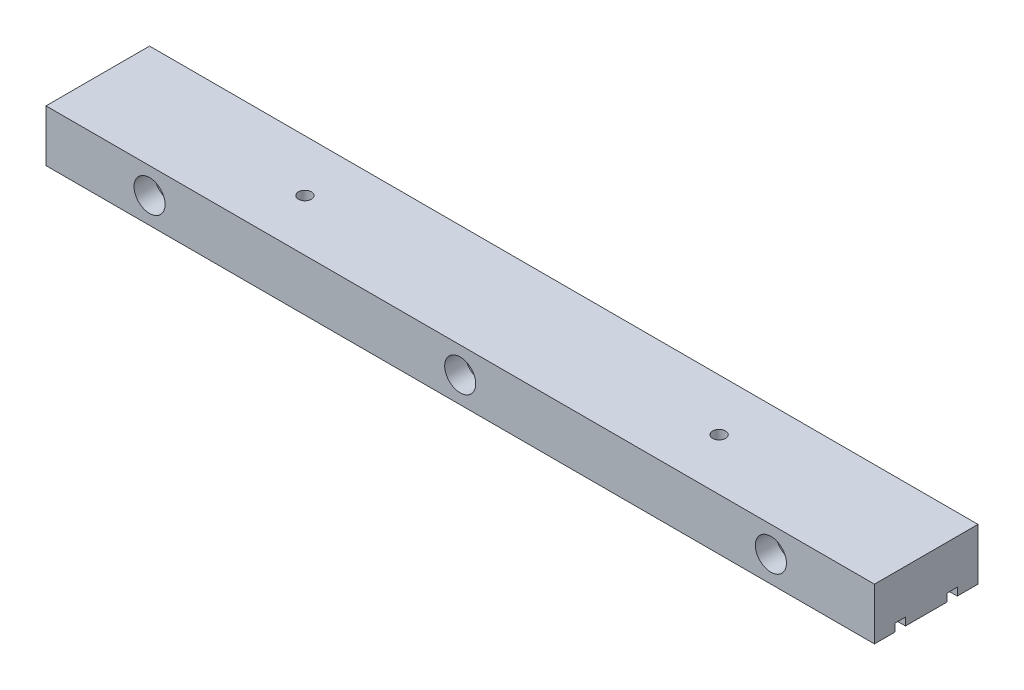
from build123d import *

# Parameters (mm, degrees)
IZIM1_W                     = 160
IZIM1_H                     = 10
Y_KSEKLIK_EKSTR_ZYON1_DEPTH = 20
IZIM6_W                     = 2
IZIM6_H                     = 1.5
KES_EKSTR_ZYON1_DEPTH       = 162.554944214
IZIM4_R                     = 1.25
CUT_EXTRUDE1_DEPTH          = 162.554944214
IZIM7_R                     = 1.25
CUT_EXTRUDE2_DEPTH          = 162.554944214
SKETCH1_R                   = 3
CUT_EXTRUDE3_DEPTH          = 4
CUT_EXTRUDE4_START          = -4
SKETCH2_R                   = 3
CUT_EXTRUDE4_DEPTH          = 4


with BuildPart() as part:
    # Çizim1 → Yükseklik-Ekstrüzyon1 (new body)
    with BuildSketch(Plane.XY):
        with Locations((80, 5)):
            Rectangle(IZIM1_W, IZIM1_H)
    extrude(amount=Y_KSEKLIK_EKSTR_ZYON1_DEPTH)

    # Çizim6 → Kes-Ekstrüzyon1 (cut, through all)
    with BuildSketch(Plane.ZY):
        with Locations((5, 0.75)):
            Rectangle(IZIM6_W, IZIM6_H)
        with Locations((15, 0.75)):
            Rectangle(IZIM6_W, IZIM6_H)
    extrude(amount=-KES_EKSTR_ZYON1_DEPTH, mode=Mode.SUBTRACT)

    # Çizim4 → Cut-Extrude1 (cut, through all)
    with BuildSketch(Plane(origin=(0, 10, 0), x_dir=(1, 0, 0), z_dir=(0, 1, 0))):
        with Locations(Location((40, -10, 0), (0, 0, 180))):
            Circle(IZIM4_R)
        with Locations(Location((120, -10, 0), (0, 0, 180))):
            Circle(IZIM4_R)
    extrude(amount=-CUT_EXTRUDE1_DEPTH, mode=Mode.SUBTRACT)

    # Çizim7 → Cut-Extrude2 (cut, through all)
    with BuildSketch(Plane(origin=(0, 0, 0), x_dir=(-1, 0, 0), z_dir=(0, 0, -1))):
        with Locations((-140, 5)):
            Circle(IZIM7_R)
        with Locations((-80, 5)):
            Circle(IZIM7_R)
        with Locations((-20, 5)):
            Circle(IZIM7_R)
    extrude(amount=-CUT_EXTRUDE2_DEPTH, mode=Mode.SUBTRACT)

    # Sketch1 → Cut-Extrude3 (cut)
    with BuildSketch(Plane(origin=(0, 0, 0), x_dir=(-1, 0, 0), z_dir=(0, 0, -1))):
        with Locations((-140, 5)):
            Circle(SKETCH1_R)
        with Locations((-80, 5)):
            Circle(SKETCH1_R)
        with Locations((-20, 5)):
            Circle(SKETCH1_R)
    extrude(amount=-CUT_EXTRUDE3_DEPTH, mode=Mode.SUBTRACT)

    # Sketch2 → Cut-Extrude4 (cut)
    with BuildSketch(Plane.XY.offset(20).offset(CUT_EXTRUDE4_START)):
        with Locations(Location((20, 5, 0), (0, 0, 180))):
            Circle(SKETCH2_R)
        with Locations(Location((80, 5, 0), (0, 0, 180))):
            Circle(SKETCH2_R)
        with Locations(Location((140, 5, 0), (0, 0, 180))):
            Circle(SKETCH2_R)
    extrude(amount=CUT_EXTRUDE4_DEPTH, mode=Mode.SUBTRACT)


solid = part.part
